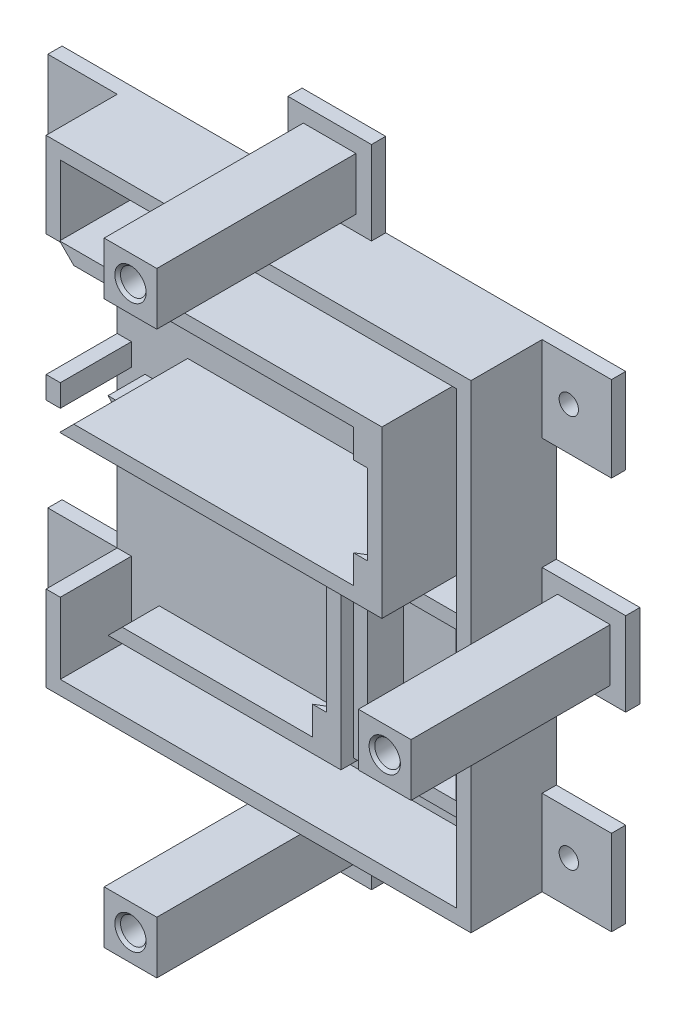
from build123d import *

# Parameters (mm, degrees)
SKETCH1_R            = 1.7
BOSS_EXTRUDE1_DEPTH  = 2.5
SKETCH1_6_W          = 2.5
SKETCH1_6_H          = 3.9
SKETCH1_6_H_2        = 7.5
BOSS_EXTRUDE3_DEPTH  = 15
BOSS_EXTRUDE8_DEPTH  = 20
BOSS_EXTRUDE9_DEPTH  = 6.5
SKETCH6_9_W          = 23.02
SKETCH6_9_H          = 31.09
SKETCH6_9_W_2        = 18.02
SKETCH6_9_H_2        = 26.09
BOSS_EXTRUDE13_DEPTH = 6.28
SKETCH7_W            = 9.25
SKETCH7_H            = 9.25
BOSS_EXTRUDE14_DEPTH = 35
SKETCH8_R            = 2.25
CUT_EXTRUDE1_DEPTH   = 6.2
CHAMFER1_SIZE        = 0.5
SKETCH9_W            = 1.37
SKETCH9_H            = 5
BOSS_EXTRUDE15_DEPTH = 2.5
CUT_EXTRUDE2_DEPTH   = 5
SKETCH12_W           = 1.38
SKETCH12_H           = 5
BOSS_EXTRUDE16_DEPTH = 2.5
CUT_EXTRUDE3_DEPTH   = 5
CUT_EXTRUDE4_DEPTH   = 5
SKETCH15_W           = 1.38
SKETCH15_H           = 5
BOSS_EXTRUDE17_DEPTH = 2.5
CUT_EXTRUDE5_DEPTH   = 5
CUT_EXTRUDE6_DEPTH   = 5
CUT_EXTRUDE7_DEPTH   = 5


with BuildPart() as part:
    # Sketch1 → Boss-Extrude1 (new body)
    with BuildSketch(Plane.XY):
        Polygon((-49.525, 42.025), (-49.525, 27.025), (-37.335, 27.025), (-37.335, -27.025), (-49.525, -27.025), (-49.525, -42.025), (-7.345, -42.025), (-7.345, -56.715), (7.345, -56.715), (7.345, -42.025), (49.525, -42.025), (49.525, -27.025), (37.335, -27.025), (37.335, -7.345), (52.025, -7.345), (52.025, 7.345), (37.335, 7.345), (37.335, 27.025), (49.525, 27.025), (49.525, 42.025), (7.345, 42.025), (7.345, 56.715), (-7.345, 56.715), (-7.345, 42.025), align=None)
        with Locations((-42.025, -34.525)):
            Circle(SKETCH1_R, mode=Mode.SUBTRACT)
        with Locations((42.025, -34.525)):
            Circle(SKETCH1_R, mode=Mode.SUBTRACT)
        with Locations((-42.025, 34.525)):
            Circle(SKETCH1_R, mode=Mode.SUBTRACT)
        with Locations((42.025, 34.525)):
            Circle(SKETCH1_R, mode=Mode.SUBTRACT)
    extrude(amount=BOSS_EXTRUDE1_DEPTH)

    # Sketch1<6> → Boss-Extrude3 (add)
    with BuildSketch(Plane.XY):
        Polygon((-34.525, -39.525), (-34.525, -42.025), (-7.345, -42.025), (7.345, -42.025), (34.525, -42.025), (34.525, -39.525), align=None)
        Polygon((-34.525, 39.525), (34.525, 39.525), (34.525, 42.025), (7.345, 42.025), (-7.345, 42.025), (-34.525, 42.025), align=None)
        Polygon((34.835, 27.025), (34.835, -27.025), (37.335, -27.025), (37.335, -7.345), (37.335, 7.345), (37.335, 27.025), align=None)
        with Locations((-36.085, 3.675)):
            Rectangle(SKETCH1_6_W, SKETCH1_6_H)
        Polygon((34.835, 39.525), (34.835, 27.025), (37.335, 27.025), (37.335, 42.025), (34.525, 42.025), (34.525, 39.525), align=None)
        Polygon((34.835, -39.525), (34.525, -39.525), (34.525, -42.025), (37.335, -42.025), (37.335, -27.025), (34.835, -27.025), align=None)
        Polygon((-37.335, -34.525), (-37.335, -42.025), (-34.525, -42.025), (-34.525, -39.525), (-34.835, -39.525), (-34.835, -34.525), align=None)
        Polygon((-37.335, -34.182141508), (-37.335, -34.525), (-34.835, -34.525), (-34.835, -27.025), (-37.335, -27.025), align=None)
        with Locations((-36.085, 30.775)):
            Rectangle(SKETCH1_6_W, SKETCH1_6_H_2)
        Polygon((-37.335, 34.525), (-34.835, 34.525), (-34.835, 39.525), (-34.525, 39.525), (-34.525, 42.025), (-37.335, 42.025), align=None)
    extrude(amount=BOSS_EXTRUDE3_DEPTH)

    # Sketch6 → Boss-Extrude8 (add)
    with BuildSketch(Plane.XY.offset(2.5)):
        Polygon((26.685, 32.145), (-24.955, 32.145), (-27.455, 34.645), (29.185, 34.645), (29.185, 5.505), (-27.455, 5.505), (-24.955, 8.005), (26.685, 8.005), align=None)
    extrude(amount=BOSS_EXTRUDE8_DEPTH)

    # Sketch6<4> → Boss-Extrude9 (add)
    with BuildSketch(Plane.XY.offset(2.5)):
        Polygon((5.985, -0.655), (-29.955, -0.655), (-32.455, 1.845), (8.485, 1.845), (8.485, -34.645), (-32.455, -34.645), (-29.955, -32.145), (5.985, -32.145), align=None)
    extrude(amount=BOSS_EXTRUDE9_DEPTH)

    # Sketch6<9> → Boss-Extrude13 (add)
    with BuildSketch(Plane.XY.offset(2.5)):
        with Locations((21.945, -16.4)):
            Rectangle(SKETCH6_9_W, SKETCH6_9_H)
        with Locations((21.945, -16.4)):
            Rectangle(SKETCH6_9_W_2, SKETCH6_9_H_2, mode=Mode.SUBTRACT)
    extrude(amount=BOSS_EXTRUDE13_DEPTH)

    # Sketch7 → Boss-Extrude14 (add)
    with BuildSketch(Plane.XY.offset(2.5)):
        with Locations((0, 49.37)):
            Rectangle(SKETCH7_W, SKETCH7_H)
        with Locations((44.68, 0)):
            Rectangle(SKETCH7_W, SKETCH7_H)
        with Locations((0, -49.37)):
            Rectangle(SKETCH7_W, SKETCH7_H)
    extrude(amount=BOSS_EXTRUDE14_DEPTH)

    # Sketch8 → Cut-Extrude1 (cut)
    with BuildSketch(Plane.XY.offset(37.5)):
        with Locations((0, -49.37)):
            Circle(SKETCH8_R)
        with Locations((44.68, 0)):
            Circle(SKETCH8_R)
        with Locations((0, 49.37)):
            Circle(SKETCH8_R)
    extrude(amount=-CUT_EXTRUDE1_DEPTH, mode=Mode.SUBTRACT)

    # Chamfer1
    chamfer1_edges = [part.edges().sort_by_distance(p)[0] for p in [
        (-2.25, -49.37, 37.5),
        (42.43, 0, 37.5),
        (-2.25, 49.37, 37.5),
    ]]
    chamfer(chamfer1_edges, length=CHAMFER1_SIZE)

    # Sketch9 → Boss-Extrude15 (add)
    with BuildSketch(Plane.ZY.offset(-26.685)):
        with Locations((21.815, 29.645)):
            Rectangle(SKETCH9_W, SKETCH9_H)
        with Locations((21.815, 10.505)):
            Rectangle(SKETCH9_W, SKETCH9_H)
    extrude(amount=BOSS_EXTRUDE15_DEPTH)

    # Sketch10 → Cut-Extrude2 (cut)
    with BuildSketch(Plane(origin=(0, 27.145, 0), x_dir=(1, 0, 0), z_dir=(0, 1, 0))):
        Polygon((26.435, -21.13), (24.185, -22.5), (24.185, -21.13), align=None)
    extrude(amount=CUT_EXTRUDE2_DEPTH, mode=Mode.SUBTRACT)

    # Sketch12 → Boss-Extrude16 (add)
    with BuildSketch(Plane.ZY.offset(-30.955)):
        with Locations((8.09, -5.855)):
            Rectangle(SKETCH12_W, SKETCH12_H)
        with Locations((8.09, -26.945)):
            Rectangle(SKETCH12_W, SKETCH12_H)
    extrude(amount=BOSS_EXTRUDE16_DEPTH)

    # Sketch13 → Cut-Extrude3 (cut)
    with BuildSketch(Plane.XZ.offset(8.355)):
        Polygon((30.705, 7.4), (28.455, 8.78), (28.455, 7.4), align=None)
    extrude(amount=-CUT_EXTRUDE3_DEPTH, mode=Mode.SUBTRACT)

    # Sketch14 → Cut-Extrude4 (cut)
    with BuildSketch(Plane(origin=(0, -24.445, 0), x_dir=(1, 0, 0), z_dir=(0, 1, 0))):
        Polygon((30.705, -7.4), (28.455, -8.78), (28.455, -7.4), align=None)
    extrude(amount=-CUT_EXTRUDE4_DEPTH, mode=Mode.SUBTRACT)

    # Sketch15 → Boss-Extrude17 (add)
    with BuildSketch(Plane.ZY.offset(-5.985)):
        with Locations((8.31, -3.155)):
            Rectangle(SKETCH15_W, SKETCH15_H)
        with Locations((8.31, -29.645)):
            Rectangle(SKETCH15_W, SKETCH15_H)
    extrude(amount=BOSS_EXTRUDE17_DEPTH)

    # Sketch16 → Cut-Extrude5 (cut)
    with BuildSketch(Plane.XZ.offset(5.655)):
        Polygon((3.485, 9), (3.485, 7.62), (5.735, 7.62), align=None)
    extrude(amount=-CUT_EXTRUDE5_DEPTH, mode=Mode.SUBTRACT)

    # Sketch17 → Cut-Extrude6 (cut)
    with BuildSketch(Plane(origin=(0, -27.145, 0), x_dir=(1, 0, 0), z_dir=(0, 1, 0))):
        Polygon((3.485, -9), (3.485, -7.62), (5.735, -7.62), align=None)
    extrude(amount=-CUT_EXTRUDE6_DEPTH, mode=Mode.SUBTRACT)

    # Sketch18 → Cut-Extrude7 (cut)
    with BuildSketch(Plane(origin=(0, 13.005, 0), x_dir=(1, 0, 0), z_dir=(0, 1, 0))):
        Polygon((24.185, -22.5), (24.185, -21.13), (26.435, -21.13), align=None)
    extrude(amount=-CUT_EXTRUDE7_DEPTH, mode=Mode.SUBTRACT)


solid = part.part
